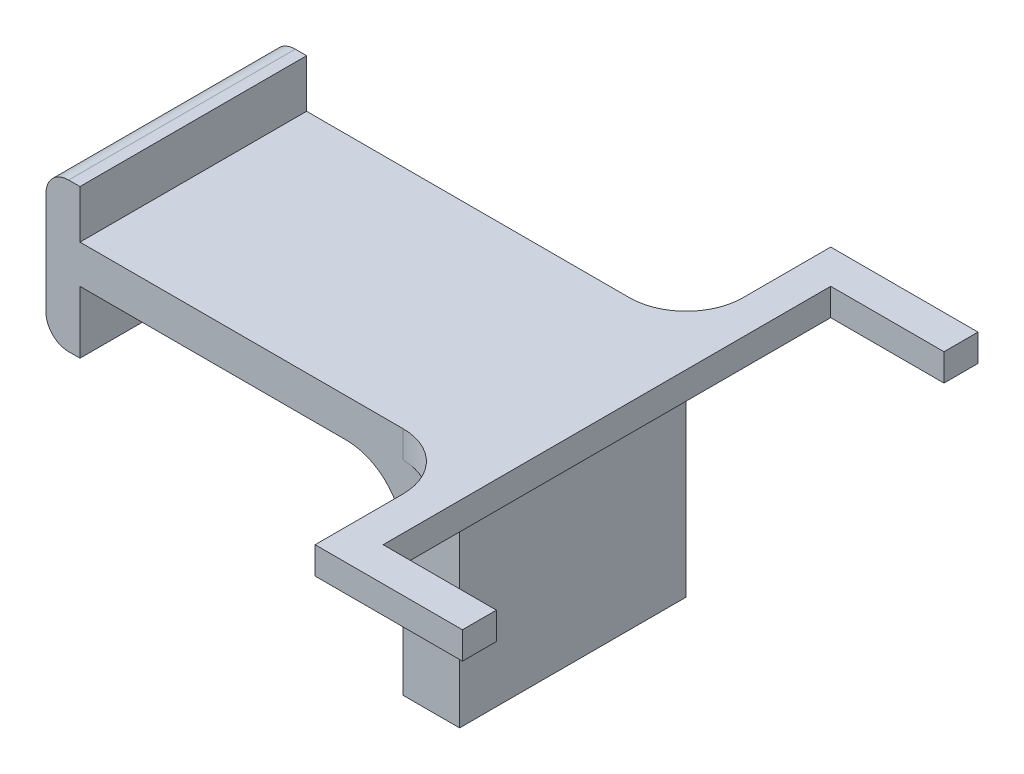
from build123d import *

# Parameters (mm, degrees)
SKETCH1_W           = 33.5
SKETCH1_H           = 20
BOSS_EXTRUDE1_DEPTH = 2.4
BOSS_EXTRUDE2_DEPTH = 10
FILLET1_R           = 5
FILLET2_R           = 5
FILLET3_R           = 2


with BuildPart() as part:
    # Sketch1 → Boss-Extrude1 (new body)
    with BuildSketch(Plane(origin=(0, 0, 0), x_dir=(1, 0, 0), z_dir=(0, 1, 0))):
        with Locations((-29.75, 0)):
            Rectangle(SKETCH1_W, SKETCH1_H)
        Polygon((-10, -19.75), (-10, 19.75), (0, 19.75), (0, 22.75), (-13, 22.75), (-13, -22.75), (0, -22.75), (0, -19.75), align=None)
    extrude(amount=-BOSS_EXTRUDE1_DEPTH)

    # Sketch3 → Boss-Extrude2 (add, symmetric)
    with BuildSketch(Plane.XY):
        Polygon((-13, -2.4), (-13, -20.38), (-18, -20.38), (-18, -3.38), (-46.5, -3.38), (-46.5, -8.875), (-49.5, -8.875), (-49.5, 4.25), (-46.5, 4.25), (-46.5, -2.4), align=None)
    extrude(amount=BOSS_EXTRUDE2_DEPTH, both=True)

    # Fillet1
    fillet1_edges = [part.edges().sort_by_distance(p)[0] for p in [
        (-13, -1.2, -10),
        (-13, -1.2, 10),
    ]]
    fillet(fillet1_edges, radius=FILLET1_R)

    # Fillet2
    fillet2_edges = [part.edges().sort_by_distance(p)[0] for p in [
        (-18, -3.38, 0),
    ]]
    fillet(fillet2_edges, radius=FILLET2_R)

    # Fillet3
    fillet3_edges = [part.edges().sort_by_distance(p)[0] for p in [
        (-49.5, 4.25, 0),
        (-49.5, -8.875, 0),
    ]]
    fillet(fillet3_edges, radius=FILLET3_R)


solid = part.part
